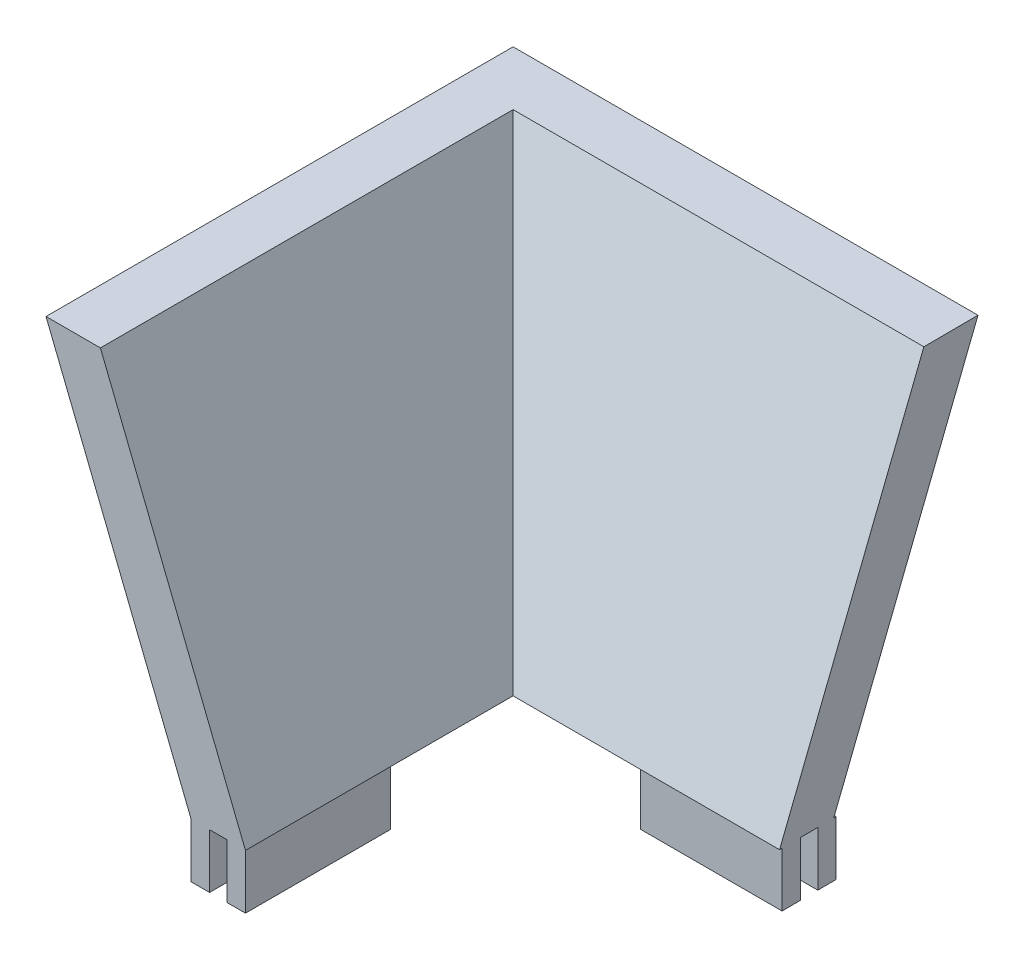
from build123d import *

# Parameters (mm, degrees)
SKETCH5_W               = 6.477
SKETCH5_H               = 101.6
SKETCH5_W_2             = 101.6
SKETCH5_H_2             = 6.477
BOSS_EXTRUDE1_DEPTH     = 19.05
CUT_EXTRUDE2_DEPTH      = 251.206
CUT_EXTRUDE2_DEPTH_BACK = 164.846


with BuildPart() as part:
    # Sketch2 → Loft1 section 0
    with BuildSketch(Plane(origin=(0, 127, 0), x_dir=(1, 0, 0), z_dir=(0, 1, 0))):
        with BuildLine():
            Line((-50.8, -50.8), (278.13, -50.8))
            Line((278.13, -50.8), (278.13, 276.352))
            Line((278.13, 276.352), (-50.8, 276.352))
            Line((-50.8, 276.352), (-50.8, -50.8))
        make_face()
    # Sketch1 → Loft1 section 1
    with BuildSketch(Plane(origin=(0, 0, 0), x_dir=(1, 0, 0), z_dir=(0, 1, 0))):
        with BuildLine():
            Line((0, 0), (227.33, 0))
            Line((227.33, 0), (227.33, 225.552))
            Line((227.33, 225.552), (0, 225.552))
            Line((0, 225.552), (0, 0))
        make_face()
    loft()

    # Sketch4 → Cut-Loft3 section 0
    with BuildSketch(Plane.XZ):
        with BuildLine():
            Line((208.28, -19.05), (19.05, -19.05))
            Line((19.05, -19.05), (19.05, -206.502))
            Line((19.05, -206.502), (208.28, -206.502))
            Line((208.28, -206.502), (208.28, -19.05))
        make_face()
    # Sketch3 → Cut-Loft3 section 1
    with BuildSketch(Plane(origin=(0, 127, 0), x_dir=(1, 0, 0), z_dir=(0, 1, 0))):
        with BuildLine():
            Line((-31.75, 257.302), (-31.75, -31.75))
            Line((-31.75, -31.75), (259.08, -31.75))
            Line((259.08, -31.75), (259.08, 257.302))
            Line((259.08, 257.302), (-31.75, 257.302))
        make_face()
    loft(mode=Mode.SUBTRACT)

    # Sketch5 → Boss-Extrude1 (add)
    with BuildSketch(Plane.XZ):
        with Locations((3.2385, -112.776)):
            Rectangle(SKETCH5_W, SKETCH5_H)
        with Locations((15.8115, -112.776)):
            Rectangle(SKETCH5_W, SKETCH5_H)
        with Locations((113.665, -2.3495)):
            Rectangle(SKETCH5_W_2, SKETCH5_H_2)
        with Locations((113.665, -14.9225)):
            Rectangle(SKETCH5_W_2, SKETCH5_H_2)
        with Locations((224.0915, -112.776)):
            Rectangle(SKETCH5_W, SKETCH5_H)
        with Locations((211.5185, -112.776)):
            Rectangle(SKETCH5_W, SKETCH5_H)
        with Locations((113.665, -223.2025)):
            Rectangle(SKETCH5_W_2, SKETCH5_H_2)
        with Locations((113.665, -210.6295)):
            Rectangle(SKETCH5_W_2, SKETCH5_H_2)
    extrude(amount=BOSS_EXTRUDE1_DEPTH)

    # Sketch6 → Cut-Extrude2 (cut, two sides: drawn at the far end of the back side and taken through both)
    with BuildSketch(Plane(origin=(0, 0, 0), x_dir=(1, 0, 0), z_dir=(0, 1, 0)).offset(-CUT_EXTRUDE2_DEPTH_BACK)):
        Polygon((278.13, 276.352), (112.012514998, 276.352), (112.838757499, 112.776), (278.13, 112.776), align=None)
        Polygon((278.13, 112.776), (112.838757499, 112.776), (113.665, -50.8), (278.13, -50.8), align=None)
        Polygon((113.665, -50.8), (112.838757499, 112.776), (-50.8, 112.776), (-50.8, -50.8), align=None)
    extrude(amount=CUT_EXTRUDE2_DEPTH + CUT_EXTRUDE2_DEPTH_BACK, mode=Mode.SUBTRACT)


solid = part.part
